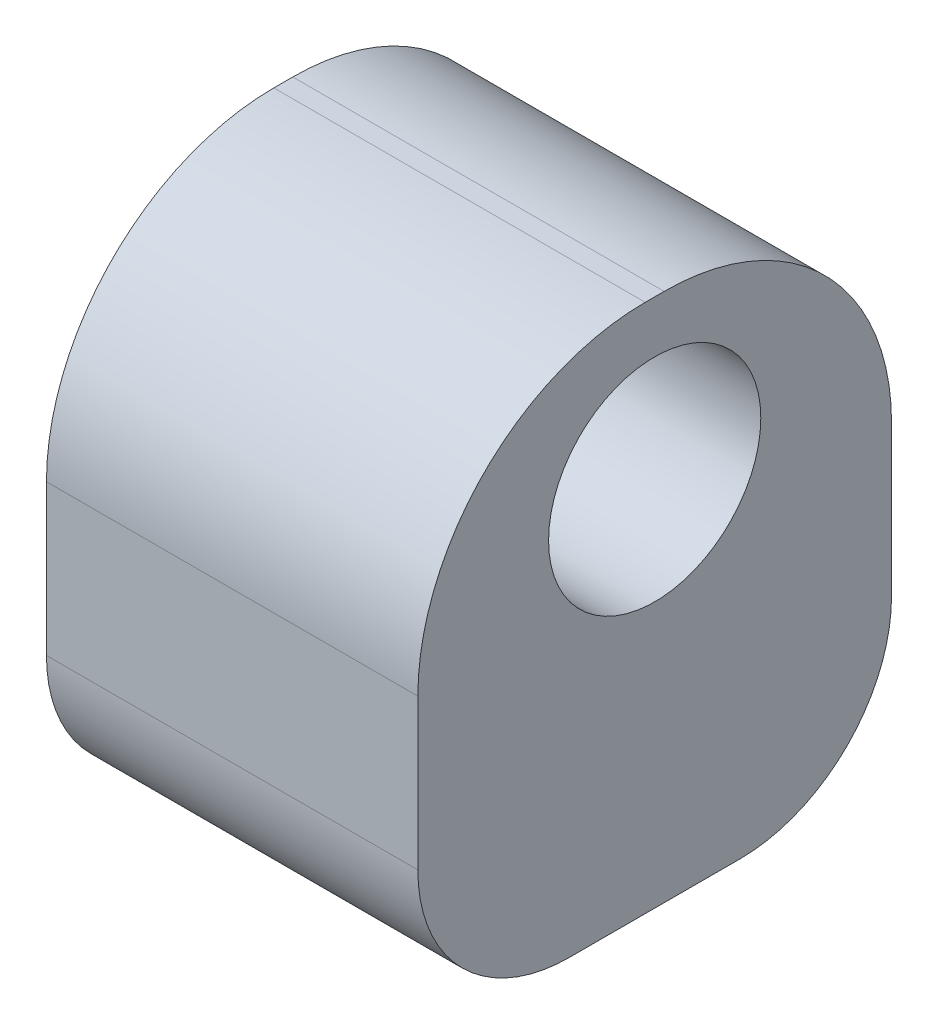
from build123d import *

# Parameters (mm, degrees)
SKETCH1_W           = 50.8
SKETCH1_H           = 9.525
BOSS_EXTRUDE1_DEPTH = 12.446
SKETCH6_R           = 1.905
CUT_EXTRUDE4_DEPTH  = 12.446
SKETCH7_R           = 3.556
CUT_EXTRUDE5_DEPTH  = 5.08
SKETCH8_W           = 38.1
SKETCH8_H           = 9.525
CUT_EXTRUDE6_DEPTH  = 12.446
FILLET2_R           = 2.54
CUT_EXTRUDE7_START  = -12.446
CUT_EXTRUDE7_DEPTH  = 12.446
FILLET4_R           = 5.08
SKETCH11_W          = 12.446
SKETCH11_H          = 9.525
BOSS_EXTRUDE2_DEPTH = 6.35
CUT_EXTRUDE8_START  = -12.446
SKETCH12_W          = 0.254
SKETCH12_H          = 9.525
CUT_EXTRUDE8_DEPTH  = 12.446
CUT_EXTRUDE9_START  = -12.446
CUT_EXTRUDE9_DEPTH  = 12.446
BOSS_EXTRUDE3_START = -12.446
BOSS_EXTRUDE3_DEPTH = 12.446
FILLET6_R           = 7.62
FILLET7_R           = 5.08


with BuildPart() as part:
    # Sketch1 → Boss-Extrude1 (new body)
    with BuildSketch(Plane.YZ):
        with Locations((-25.4, 4.7625)):
            Rectangle(SKETCH1_W, SKETCH1_H)
    extrude(amount=BOSS_EXTRUDE1_DEPTH)

    # Sketch6 → Cut-Extrude4 (cut)
    with BuildSketch(Plane.YZ.offset(12.446)):
        with Locations(Location((-44.45, 4.7625, 0), (0, 0, 270))):
            Circle(SKETCH6_R)
    extrude(amount=-CUT_EXTRUDE4_DEPTH, mode=Mode.SUBTRACT)

    # Sketch7 → Cut-Extrude5 (cut)
    with BuildSketch(Plane.YZ.offset(12.446)):
        with Locations(Location((-44.45, 4.7625, 0), (0, 0, 270))):
            Circle(SKETCH7_R)
    extrude(amount=-CUT_EXTRUDE5_DEPTH, mode=Mode.SUBTRACT)

    # Sketch8 → Cut-Extrude6 (cut)
    with BuildSketch(Plane.YZ.offset(12.446)):
        with Locations((-19.05, 4.7625)):
            Rectangle(SKETCH8_W, SKETCH8_H)
    extrude(amount=-CUT_EXTRUDE6_DEPTH, mode=Mode.SUBTRACT)

    # Fillet2
    fillet2_edges = [part.edges().sort_by_distance(p)[0] for p in [
        (6.223, -38.1, 0),
        (6.223, -38.1, 9.525),
    ]]
    fillet(fillet2_edges, radius=FILLET2_R)

    # Sketch9 → Cut-Extrude7 (cut)
    with BuildSketch(Plane.YZ.offset(12.446).offset(CUT_EXTRUDE7_START)):
        with BuildLine():
            Line((-40.64, 0), (-38.1, 2.54))
            ThreePointArc((-38.1, 2.54), (-38.843948776, 0.743948776), (-40.64, 0))
        make_face()
        with BuildLine():
            Line((-38.1, 6.985), (-40.64, 9.525))
            ThreePointArc((-40.64, 9.525), (-38.843948776, 8.781051224), (-38.1, 6.985))
        make_face()
    extrude(amount=CUT_EXTRUDE7_DEPTH, mode=Mode.SUBTRACT)

    # Fillet4
    fillet4_edges = [part.edges().sort_by_distance(p)[0] for p in [
        (6.223, -38.1, 2.54),
        (6.223, -38.1, 6.985),
    ]]
    fillet(fillet4_edges, radius=FILLET4_R)

    # Sketch11 → Boss-Extrude2 (add)
    with BuildSketch(Plane.XZ.offset(50.8)):
        with Locations((6.223, 4.7625)):
            Rectangle(SKETCH11_W, SKETCH11_H)
    extrude(amount=BOSS_EXTRUDE2_DEPTH)

    # Sketch12 → Cut-Extrude8 (cut)
    with BuildSketch(Plane.YZ.offset(12.446).offset(CUT_EXTRUDE8_START)):
        with Locations((-57.023, 4.7625)):
            Rectangle(SKETCH12_W, SKETCH12_H)
    extrude(amount=CUT_EXTRUDE8_DEPTH, mode=Mode.SUBTRACT)

    # Sketch13 → Cut-Extrude9 (cut)
    with BuildSketch(Plane.YZ.offset(12.446).offset(CUT_EXTRUDE9_START)):
        with BuildLine():
            Line((-39.153011094, 7.977528923), (-39.153011094, 1.547471077))
            ThreePointArc((-39.153011094, 1.547471077), (-38.370452015, 3.008769732), (-38.1, 4.644204897))
            Line((-38.1, 4.644204897), (-38.1, 4.880795103))
            ThreePointArc((-38.1, 4.880795103), (-38.370452015, 6.516230268), (-39.153011094, 7.977528923))
        make_face()
    extrude(amount=CUT_EXTRUDE9_DEPTH, mode=Mode.SUBTRACT)

    # Sketch14 → Boss-Extrude3 (add)
    with BuildSketch(Plane.YZ.offset(12.446).offset(BOSS_EXTRUDE3_START)):
        with BuildLine():
            Line((-39.153011094, 12.7), (-39.153011094, 7.977528923))
            ThreePointArc((-39.153011094, 7.977528923), (-39.362410998, 8.23227451), (-39.587897552, 8.472897552))
            Line((-39.587897552, 8.472897552), (-40.64, 9.525))
            Line((-40.64, 9.525), (-56.896, 9.525))
            Line((-56.896, 9.525), (-56.896, 12.7))
            Line((-56.896, 12.7), (-40.64, 12.7))
            Line((-40.64, 12.7), (-39.153011094, 12.7))
        make_face()
        with BuildLine():
            Line((-39.153011094, -3.175), (-40.64, -3.175))
            Line((-40.64, -3.175), (-56.896, -3.175))
            Line((-56.896, -3.175), (-56.896, 0))
            Line((-56.896, 0), (-40.64, 0))
            Line((-40.64, 0), (-39.587897552, 1.052102448))
            ThreePointArc((-39.587897552, 1.052102448), (-39.362410998, 1.29272549), (-39.153011094, 1.547471077))
            Line((-39.153011094, 1.547471077), (-39.153011094, -3.175))
        make_face()
    extrude(amount=BOSS_EXTRUDE3_DEPTH)

    # Fillet6
    fillet6_edges = [part.edges().sort_by_distance(p)[0] for p in [
        (6.223, -39.153011094, 12.7),
        (6.223, -39.153011094, -3.175),
    ]]
    fillet(fillet6_edges, radius=FILLET6_R)

    # Fillet7
    fillet7_edges = [part.edges().sort_by_distance(p)[0] for p in [
        (6.223, -56.896, 12.7),
        (6.223, -56.896, -3.175),
    ]]
    fillet(fillet7_edges, radius=FILLET7_R)


solid = part.part
